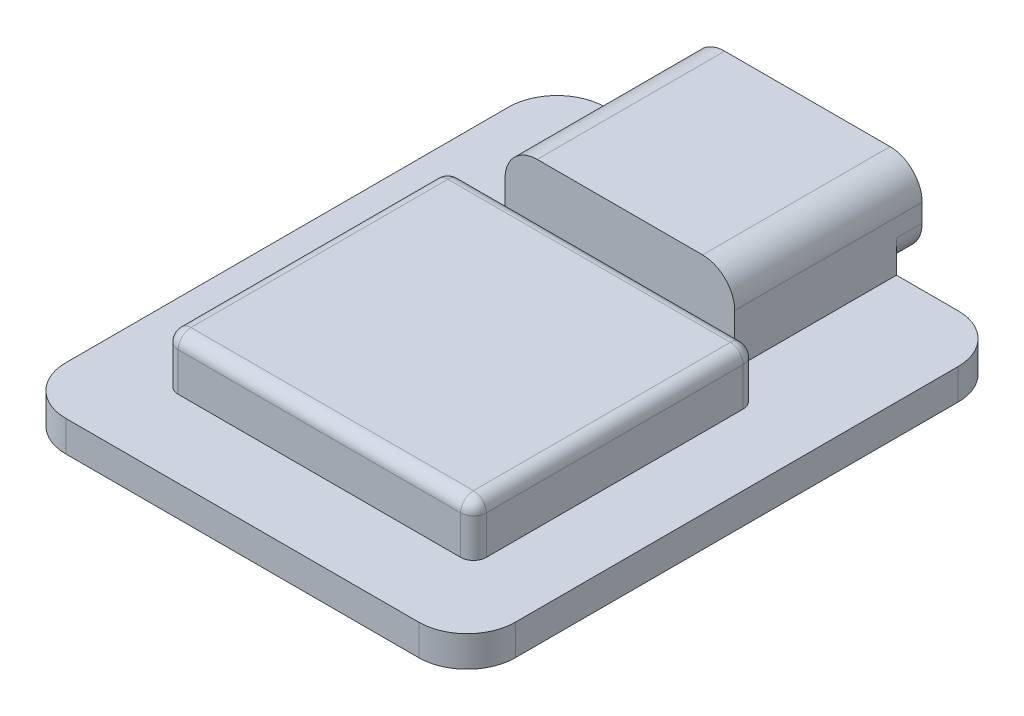
from build123d import *

# Parameters (mm, degrees)
SKETCH1_W           = 17.5
SKETCH1_H           = 21
BOSS_EXTRUDE1_DEPTH = 1.2
FILLET1_R           = 1.88
SKETCH2_W           = 12
SKETCH2_H           = 11
BOSS_EXTRUDE2_DEPTH = 2
FILLET2_R           = 0.5
SKETCH3_W           = 8.94
SKETCH3_H           = 7.3
BOSS_EXTRUDE3_DEPTH = 3.21
FILLET3_R           = 1.25
CUT_EXTRUDE1_DEPTH  = 5


with BuildPart() as part:
    # Sketch1 → Boss-Extrude1 (new body)
    with BuildSketch(Plane(origin=(0, 0, 0), x_dir=(1, 0, 0), z_dir=(0, 1, 0))):
        Rectangle(SKETCH1_W, SKETCH1_H)
    extrude(amount=BOSS_EXTRUDE1_DEPTH)

    # Fillet1
    fillet1_edges = [part.edges().sort_by_distance(p)[0] for p in [
        (-8.75, 0.6, -10.5),
        (8.75, 0.6, -10.5),
        (8.75, 0.6, 10.5),
        (-8.75, 0.6, 10.5),
    ]]
    fillet(fillet1_edges, radius=FILLET1_R)

    # Sketch2 → Boss-Extrude2 (add)
    with BuildSketch(Plane(origin=(0, 1.2, 0), x_dir=(1, 0, 0), z_dir=(0, 1, 0))):
        with Locations((0, -2)):
            Rectangle(SKETCH2_W, SKETCH2_H)
    extrude(amount=BOSS_EXTRUDE2_DEPTH)

    # Fillet2
    fillet2_edges = [part.edges().sort_by_distance(p)[0] for p in [
        (-6, 2.2, -3.5),
        (-6, 2.2, 7.5),
        (6, 2.2, 7.5),
        (6, 2.2, -3.5),
        (-6, 3.2, 2),
        (0, 3.2, 7.5),
        (6, 3.2, 2),
        (0, 3.2, -3.5),
    ]]
    fillet(fillet2_edges, radius=FILLET2_R)

    # Sketch3 → Boss-Extrude3 (add)
    with BuildSketch(Plane(origin=(0, 1.2, 0), x_dir=(1, 0, 0), z_dir=(0, 1, 0))):
        with Locations((0, 7.85)):
            Rectangle(SKETCH3_W, SKETCH3_H)
    extrude(amount=BOSS_EXTRUDE3_DEPTH)

    # Fillet3
    fillet3_edges = [part.edges().sort_by_distance(p)[0] for p in [
        (-4.47, 1.2, -11),
        (4.47, 1.2, -11),
        (-4.47, 4.41, -7.85),
        (4.47, 4.41, -7.85),
    ]]
    fillet(fillet3_edges, radius=FILLET3_R)

    # Sketch4 → Cut-Extrude1 (cut)
    with BuildSketch(Plane(origin=(0, 0, -11.5), x_dir=(-1, 0, 0), z_dir=(0, 0, -1))):
        with BuildLine():
            Line((-3.25, 3.805), (3.25, 3.805))
            ThreePointArc((3.25, 3.805), (4.25, 2.805), (3.25, 1.805))
            Line((3.25, 1.805), (-3.25, 1.805))
            ThreePointArc((-3.25, 1.805), (-4.25, 2.805), (-3.25, 3.805))
        make_face()
        with BuildLine():
            Line((-2.5, 3.305), (2.5, 3.305))
            ThreePointArc((2.5, 3.305), (3, 2.805), (2.5, 2.305))
            Line((2.5, 2.305), (-2.5, 2.305))
            ThreePointArc((-2.5, 2.305), (-3, 2.805), (-2.5, 3.305))
        make_face(mode=Mode.SUBTRACT)
    extrude(amount=-CUT_EXTRUDE1_DEPTH, mode=Mode.SUBTRACT)


solid = part.part
